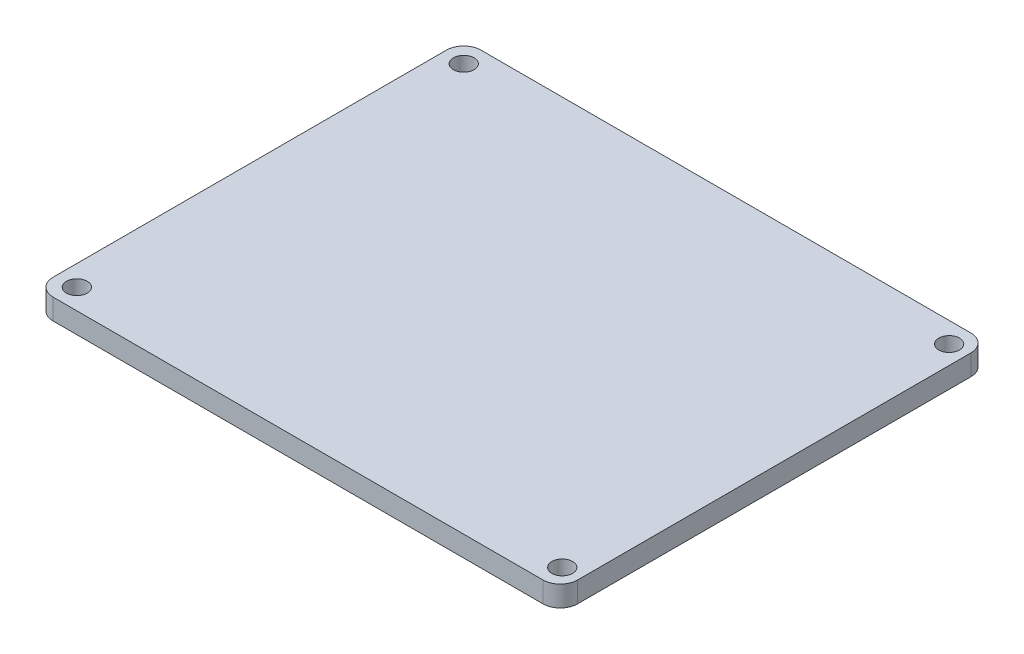
from build123d import *

# Parameters (mm, degrees)
CROQUIS1_R              = 1.5
SALIENTE_EXTRUIR1_DEPTH = 3


with BuildPart() as part:
    # Croquis1 → Saliente-Extruir1 (new body)
    with BuildSketch(Plane(origin=(0, 0, 0), x_dir=(1, 0, 0), z_dir=(0, 1, 0))):
        with BuildLine():
            Line((-35.642867408, 31), (35.357132592, 31))
            ThreePointArc((35.357132592, 31), (37.124899545, 30.267766953), (37.857132592, 28.5))
            Line((37.857132592, 28.5), (37.857132592, -28.5))
            ThreePointArc((37.857132592, -28.5), (37.124899545, -30.267766953), (35.357132592, -31))
            Line((35.357132592, -31), (-35.642867408, -31))
            ThreePointArc((-35.642867408, -31), (-37.410634361, -30.267766953), (-38.142867408, -28.5))
            Line((-38.142867408, -28.5), (-38.142867408, 28.5))
            ThreePointArc((-38.142867408, 28.5), (-37.410634361, 30.267766953), (-35.642867408, 31))
        make_face()
        with Locations(Location((-35.169540859, 28.034184865, 0), (0, 0, 270))):
            Circle(CROQUIS1_R, mode=Mode.SUBTRACT)
        with Locations(Location((35.169540859, 28.034184865, 0), (0, 0, 90))):
            Circle(CROQUIS1_R, mode=Mode.SUBTRACT)
        with Locations(Location((35.169540859, -28.034184865, 0), (0, 0, 270))):
            Circle(CROQUIS1_R, mode=Mode.SUBTRACT)
        with Locations(Location((-35.169540859, -28.034184865, 0), (0, 0, 90))):
            Circle(CROQUIS1_R, mode=Mode.SUBTRACT)
    extrude(amount=SALIENTE_EXTRUIR1_DEPTH)


solid = part.part
